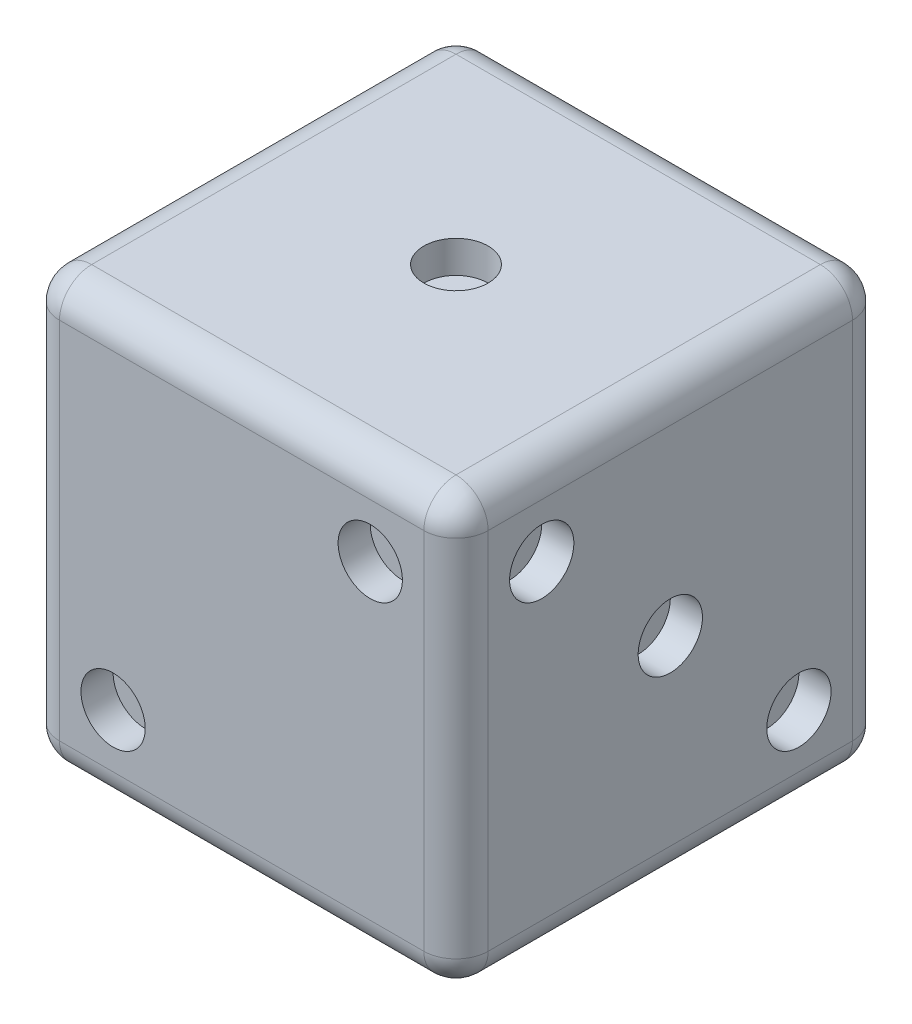
from build123d import *

# Parameters (mm, degrees)
SKETCH_1_W          = 20
SKETCH_1_H          = 20
EXTRUDE_1_DEPTH     = 20
FILLET_1_R          = 1.5
SKETCH_2_R          = 1.5
CUT_EXTRUDE_1_DEPTH = 1.5
SKETCH_3_R          = 1.5
CUT_EXTRUDE_2_DEPTH = 1.5
SKETCH_4_R          = 1.5
CUT_EXTRUDE_3_DEPTH = 1.5
CUT_EXTRUDE_START   = 1.5
SKETCH_5_R          = 1.5
CUT_EXTRUDE_4_DEPTH = 1.5
SKETCH_6_R          = 1.5
CUT_EXTRUDE_5_DEPTH = 1.5
SKETCH_7_R          = 1.5
CUT_EXTRUDE_6_DEPTH = 1.5


with BuildPart() as part:
    # 草图1 → 凸台-拉伸1 (new body)
    with BuildSketch(Plane.XY.offset(-10)):
        Rectangle(SKETCH_1_W, SKETCH_1_H)
    extrude(amount=EXTRUDE_1_DEPTH)

    # 圆角1
    fillet_1_edges = [part.edges().sort_by_distance(p)[0] for p in [
        (10, 0, 10),
        (0, 10, 10),
        (-10, 0, 10),
        (0, 10, -10),
        (10, 0, -10),
        (0, -10, -10),
        (-10, 0, -10),
        (-10, 10, 0),
        (10, 10, 0),
        (10, -10, 0),
        (-10, -10, 0),
        (0, -10, 10),
    ]]
    fillet(fillet_1_edges, radius=FILLET_1_R)

    # 草图2 → 切除-拉伸1 (cut)
    with BuildSketch(Plane(origin=(0, 10, 0), x_dir=(1, 0, 0), z_dir=(0, 1, 0))):
        with Locations(Location((0, 0, 0), (0, 0, 270))):
            Circle(SKETCH_2_R)
    extrude(amount=-CUT_EXTRUDE_1_DEPTH, mode=Mode.SUBTRACT)

    # 草图3 → 切除-拉伸2 (cut)
    with BuildSketch(Plane(origin=(0, -10, 0), x_dir=(1, 0, 0), z_dir=(0, 1, 0))):
        with Locations(Location((-3, 6, 0), (0, 0, 270))):
            Circle(SKETCH_3_R)
        with Locations(Location((-3, 0, 0), (0, 0, 270))):
            Circle(SKETCH_3_R)
        with Locations(Location((-3, -6, 0), (0, 0, 270))):
            Circle(SKETCH_3_R)
        with Locations(Location((3, 6, 0), (0, 0, 270))):
            Circle(SKETCH_3_R)
        with Locations(Location((3, 0, 0), (0, 0, 270))):
            Circle(SKETCH_3_R)
        with Locations(Location((3, -6, 0), (0, 0, 270))):
            Circle(SKETCH_3_R)
    extrude(amount=CUT_EXTRUDE_2_DEPTH, mode=Mode.SUBTRACT)

    # 草图4 → 切除-拉伸3 (cut)
    with BuildSketch(Plane.XY.offset(10)):
        with Locations((-6, -6)):
            Circle(SKETCH_4_R)
        with Locations((6, 6)):
            Circle(SKETCH_4_R)
    extrude(amount=-CUT_EXTRUDE_3_DEPTH, mode=Mode.SUBTRACT)

    # 草图5 → 切除-拉伸4 (cut)
    with BuildSketch(Plane.XY.offset(-10).offset(CUT_EXTRUDE_START)):
        with Locations((-6, -6)):
            Circle(SKETCH_5_R)
        with Locations((6, -6)):
            Circle(SKETCH_5_R)
        Circle(SKETCH_5_R)
        with Locations((-6, 6)):
            Circle(SKETCH_5_R)
        with Locations((6, 6)):
            Circle(SKETCH_5_R)
    extrude(amount=-CUT_EXTRUDE_4_DEPTH, mode=Mode.SUBTRACT)

    # 草图6 → 切除-拉伸5 (cut)
    with BuildSketch(Plane(origin=(10, 0, 0), x_dir=(0, 0, -1), z_dir=(1, 0, 0))):
        with Locations((6, -6)):
            Circle(SKETCH_6_R)
        Circle(SKETCH_6_R)
        with Locations((-6, 6)):
            Circle(SKETCH_6_R)
    extrude(amount=-CUT_EXTRUDE_5_DEPTH, mode=Mode.SUBTRACT)

    # 草图7 → 切除-拉伸6 (cut)
    with BuildSketch(Plane(origin=(-10, 0, 0), x_dir=(0, 0, -1), z_dir=(1, 0, 0)).offset(CUT_EXTRUDE_START)):
        with Locations((6, -6)):
            Circle(SKETCH_7_R)
        with Locations((-6, -6)):
            Circle(SKETCH_7_R)
        with Locations((6, 6)):
            Circle(SKETCH_7_R)
        with Locations((-6, 6)):
            Circle(SKETCH_7_R)
    extrude(amount=-CUT_EXTRUDE_6_DEPTH, mode=Mode.SUBTRACT)


solid = part.part
